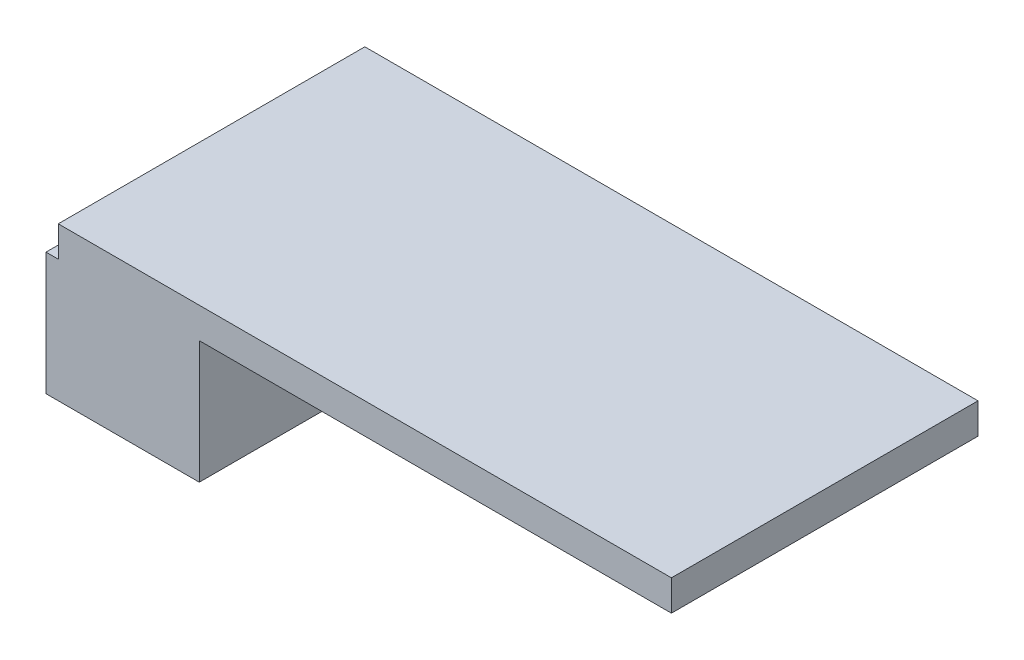
from build123d import *

# Parameters (mm, degrees)
SKETCH1_W           = 100
SKETCH1_H           = 50
BOSS_EXTRUDE1_DEPTH = 5
SKETCH2_W           = 25
SKETCH2_H           = 50
BOSS_EXTRUDE2_DEPTH = 20
SKETCH3_W           = 13
SKETCH3_H           = 13
SKETCH3_W_2         = 20
SKETCH3_H_2         = 20
SKETCH3_W_3         = 4.5
SKETCH3_H_3         = 4.5
SKETCH3_W_4         = 1
SKETCH3_H_4         = 2.5
SKETCH3_W_5         = 6
SKETCH3_H_5         = 6
BOSS_EXTRUDE3_DEPTH = 2
SKETCH4_W           = 7
SKETCH4_H           = 40
BOSS_EXTRUDE4_DEPTH = 5


with BuildPart() as part:
    # Sketch1 → Boss-Extrude1 (new body)
    with BuildSketch(Plane(origin=(0, 0, 0), x_dir=(1, 0, 0), z_dir=(0, 1, 0))):
        with Locations((50, 25)):
            Rectangle(SKETCH1_W, SKETCH1_H)
    extrude(amount=BOSS_EXTRUDE1_DEPTH)

    # Sketch2 → Boss-Extrude2 (add)
    with BuildSketch(Plane.XZ):
        with Locations((10.5, -25)):
            Rectangle(SKETCH2_W, SKETCH2_H)
    extrude(amount=BOSS_EXTRUDE2_DEPTH)

    # Sketch3 → Boss-Extrude3 (add)
    with BuildSketch(Plane.XZ):
        with Locations((62.354538524, -13.5)):
            Rectangle(SKETCH3_W, SKETCH3_H)
        with Locations((58.854538524, -35)):
            Rectangle(SKETCH3_W_2, SKETCH3_H_2)
        with Locations((41.25, -44.75)):
            Rectangle(SKETCH3_W_3, SKETCH3_H_3)
        with Locations((36.230283198, -35.23329394)):
            Rectangle(SKETCH3_W_4, SKETCH3_H_4)
        with Locations((84.854538524, -15)):
            Rectangle(SKETCH3_W_5, SKETCH3_H_5)
        with Locations((84.854538524, -24)):
            Rectangle(SKETCH3_W_5, SKETCH3_H_5)
        with Locations((84.854538524, -33)):
            Rectangle(SKETCH3_W_5, SKETCH3_H_5)
        with Locations((84.854538524, -42)):
            Rectangle(SKETCH3_W_5, SKETCH3_H_5)
        with Locations((34.75, -44.75)):
            Rectangle(SKETCH3_W_3, SKETCH3_H_3)
        with Locations((28.25, -44.75)):
            Rectangle(SKETCH3_W_3, SKETCH3_H_3)
        with Locations((40.25, -36.25)):
            Rectangle(SKETCH3_W_3, SKETCH3_H_3)
        with Locations((28.25, -36.25)):
            Rectangle(SKETCH3_W_3, SKETCH3_H_3)
        with Locations((34.056841582, -35.253056661)):
            Rectangle(SKETCH3_W_4, SKETCH3_H_4)
        with Locations((32.169211896, -35.217412145)):
            Rectangle(SKETCH3_W_4, SKETCH3_H_4)
        with Locations((38.888023686, -30.936743788)):
            Rectangle(SKETCH3_W_4, SKETCH3_H_4)
        with Locations((40.525487338, -30.924614304)):
            Rectangle(SKETCH3_W_4, SKETCH3_H_4)
        with Locations((50.783834941, -47.406763186)):
            Rectangle(SKETCH3_W_4, SKETCH3_H_4)
        with Locations((52.26338259, -47.478555209)):
            Rectangle(SKETCH3_W_4, SKETCH3_H_4)
        with Locations((54.55859758, -47.386324582)):
            Rectangle(SKETCH3_W_4, SKETCH3_H_4)
        with Locations((56.374406059, -47.474432974)):
            Rectangle(SKETCH3_W_4, SKETCH3_H_4)
        with Locations((58.792603581, -47.659638141)):
            Rectangle(SKETCH3_W_4, SKETCH3_H_4)
        with Locations((61.225203353, -47.50620675)):
            Rectangle(SKETCH3_W_4, SKETCH3_H_4)
        with Locations((63.310020495, -47.607368237)):
            Rectangle(SKETCH3_W_4, SKETCH3_H_4)
        with Locations((65.19308114, -47.698739903)):
            Rectangle(SKETCH3_W_4, SKETCH3_H_4)
        with Locations((67.695813528, -47.480844473)):
            Rectangle(SKETCH3_W_4, SKETCH3_H_4)
        with Locations((51.620089841, -22.168837292)):
            Rectangle(SKETCH3_W_4, SKETCH3_H_4)
        with Locations((54.828135526, -22.168837292)):
            Rectangle(SKETCH3_W_4, SKETCH3_H_4)
        with Locations((57.621886299, -22.168837292)):
            Rectangle(SKETCH3_W_4, SKETCH3_H_4)
        with Locations((60.182498208, -22.168837292)):
            Rectangle(SKETCH3_W_4, SKETCH3_H_4)
        with Locations((64.118696459, -22.168837292)):
            Rectangle(SKETCH3_W_4, SKETCH3_H_4)
        with Locations((62.314527943, -22.168837292)):
            Rectangle(SKETCH3_W_4, SKETCH3_H_4)
        with Locations((67.001738379, -22.168837292)):
            Rectangle(SKETCH3_W_4, SKETCH3_H_4)
        with Locations((58.263095719, -3.26300702)):
            Rectangle(SKETCH3_W_4, SKETCH3_H_4)
        with Locations((60.618093401, -3.26300702)):
            Rectangle(SKETCH3_W_4, SKETCH3_H_4)
        with Locations((62.890151559, -3.26300702)):
            Rectangle(SKETCH3_W_4, SKETCH3_H_4)
        with Locations((65.395210185, -3.26300702)):
            Rectangle(SKETCH3_W_4, SKETCH3_H_4)
        with Locations((66.760195848, -3.26300702)):
            Rectangle(SKETCH3_W_4, SKETCH3_H_4)
    extrude(amount=BOSS_EXTRUDE3_DEPTH)

    # Sketch4 → Boss-Extrude4 (add)
    with BuildSketch(Plane.XZ):
        with Locations((76.072105727, -25)):
            Rectangle(SKETCH4_W, SKETCH4_H)
    extrude(amount=BOSS_EXTRUDE4_DEPTH)


solid = part.part
